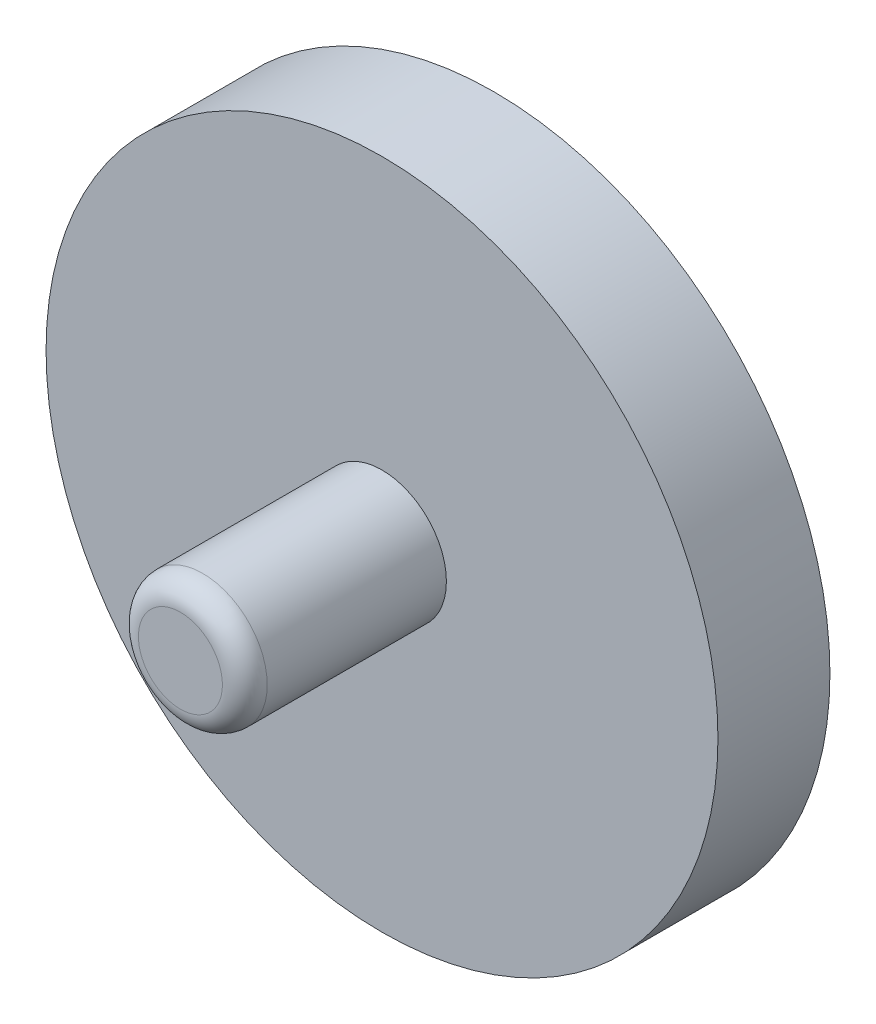
from build123d import *

# Parameters (mm, degrees)
SKETCH1_R           = 7.5
BOSS_EXTRUDE1_DEPTH = 2.5
SKETCH2_R           = 1.4375
BOSS_EXTRUDE2_DEPTH = 4.5
FILLET1_R           = 0.5


with BuildPart() as part:
    # Sketch1 → Boss-Extrude1 (new body)
    with BuildSketch(Plane.XY):
        Circle(SKETCH1_R)
    extrude(amount=BOSS_EXTRUDE1_DEPTH)

    # Sketch2 → Boss-Extrude2 (add)
    with BuildSketch(Plane.XY.offset(2.5)):
        Circle(SKETCH2_R)
    extrude(amount=BOSS_EXTRUDE2_DEPTH)

    # Fillet1
    fillet1_edges = [part.edges().sort_by_distance(p)[0] for p in [
        (-1.4375, 0, 7),
    ]]
    fillet(fillet1_edges, radius=FILLET1_R)


solid = part.part
